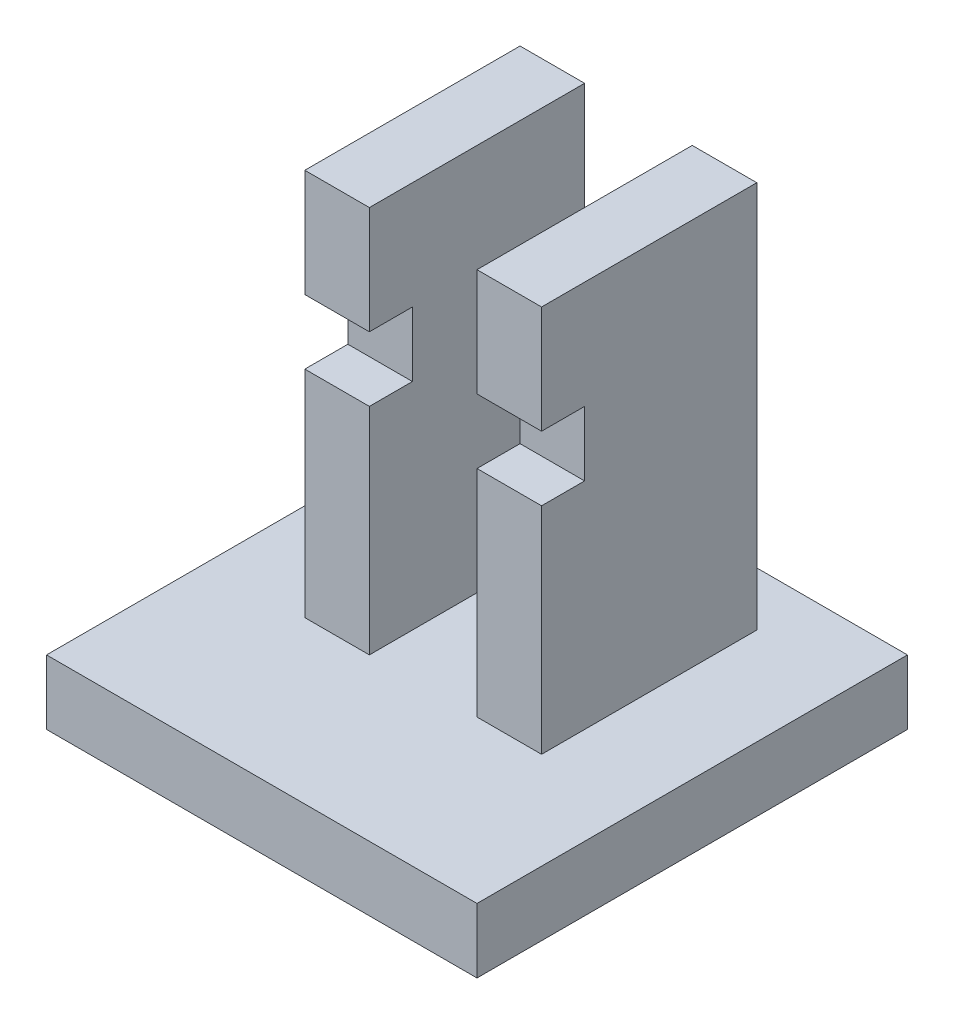
from build123d import *

# Parameters (mm, degrees)
SKETCH1_W             = 3
SKETCH1_H             = 10
BOSS_EXTRUDE1_DEPTH   = 18
BOSS_EXTRUDE1_2_DEPTH = 18
SKETCH2_W             = 20
SKETCH2_H             = 5
SKETCH2_H_2           = 15
BOSS_EXTRUDE2_DEPTH   = 3
SKETCH3_W             = 11
SKETCH3_H             = 3
CUT_EXTRUDE1_DEPTH    = 2


with BuildPart() as part:
    # Sketch1 → Boss-Extrude1 (new body)
    with BuildSketch(Plane(origin=(0, 0, 0), x_dir=(1, 0, 0), z_dir=(0, 1, 0))):
        with Locations((-4, 0)):
            Rectangle(SKETCH1_W, SKETCH1_H)
    extrude(amount=BOSS_EXTRUDE1_DEPTH)



with BuildPart() as body_2:
    # Sketch1 → Boss-Extrude1 2 (new body)
    with BuildSketch(Plane(origin=(0, 0, 0), x_dir=(1, 0, 0), z_dir=(0, 1, 0))):
        with Locations((4, 0)):
            Rectangle(SKETCH1_W, SKETCH1_H)
    extrude(amount=BOSS_EXTRUDE1_2_DEPTH)


with BuildPart() as part_1:
    add(part.part)

    add(body_2.part)  # Boss-Extrude2 merges body 2
    # Sketch2 → Boss-Extrude2 (add)
    with BuildSketch(Plane.XZ):
        with Locations((0, 10)):
            Rectangle(SKETCH2_W, SKETCH2_H)
        Rectangle(SKETCH2_W, SKETCH2_H_2)
    extrude(amount=BOSS_EXTRUDE2_DEPTH)

    # Sketch3 → Cut-Extrude1 (cut)
    with BuildSketch(Plane.XY.offset(5)):
        with Locations((0, 11.5)):
            Rectangle(SKETCH3_W, SKETCH3_H)
    extrude(amount=-CUT_EXTRUDE1_DEPTH, mode=Mode.SUBTRACT)


solid = part_1.part
